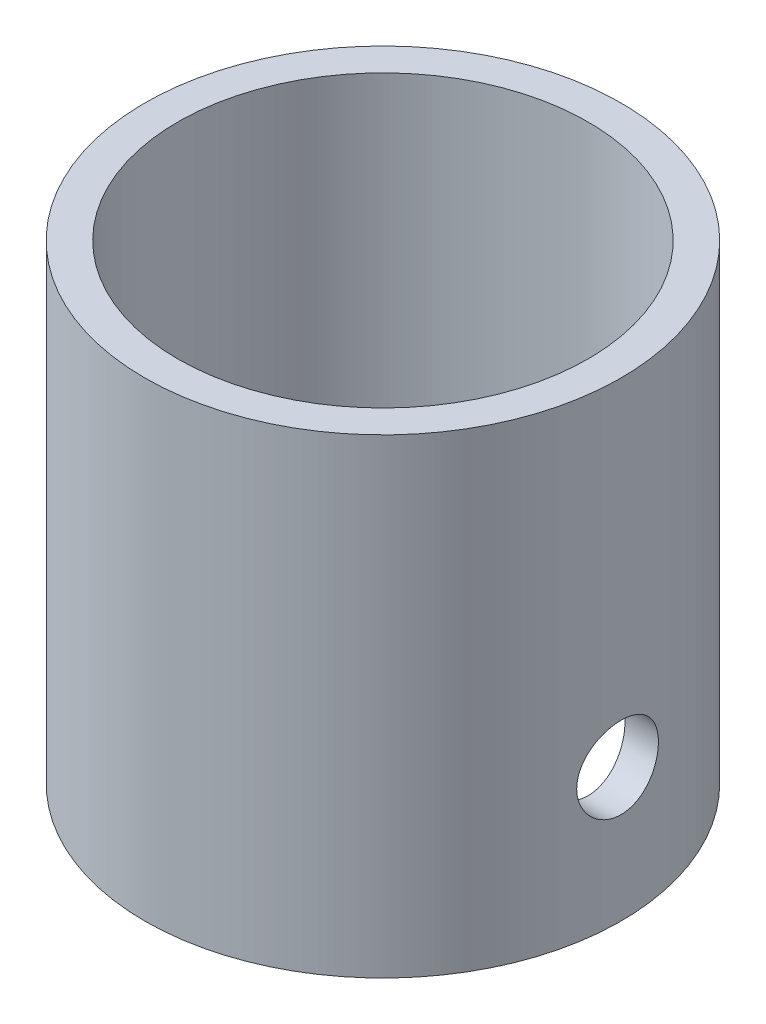
from build123d import *

# Parameters (mm, degrees)
SKETCH2_R               = 20.25
SKETCH2_R_2             = 17.451210961
BOSS_EXTRUDE1_DEPTH     = 40
CUT_EXTRUDE1_DEPTH      = 40
CUT_EXTRUDE1_DEPTH_BACK = 40
SKETCH5_R               = 3.475


with BuildPart() as part:
    # Sketch2 → Boss-Extrude1 (new body)
    with BuildSketch(Plane(origin=(0, 0, 0), x_dir=(1, 0, 0), z_dir=(0, 1, 0))):
        Circle(SKETCH2_R)
        Circle(SKETCH2_R_2, mode=Mode.SUBTRACT)
    extrude(amount=BOSS_EXTRUDE1_DEPTH)

    # Sketch5 → Cut-Extrude1 (cut, two sides: drawn at the far end of the back side and taken through both)
    with BuildSketch(Plane(origin=(0, 0, 0), x_dir=(0, 0, -1), z_dir=(1, 0, 0)).offset(-CUT_EXTRUDE1_DEPTH_BACK)):
        with Locations((0, 11.317045128)):
            Circle(SKETCH5_R)
    extrude(amount=CUT_EXTRUDE1_DEPTH + CUT_EXTRUDE1_DEPTH_BACK, mode=Mode.SUBTRACT)


solid = part.part
